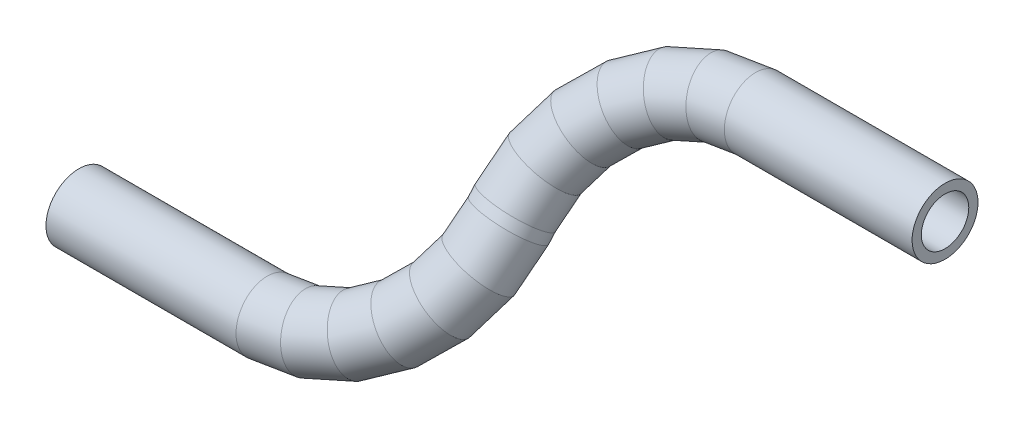
from build123d import *

# Parameters (mm, degrees)
PROFILE_R   = 3.175
PROFILE_R_2 = 2.286


with BuildPart() as part:
    # Tube: sweep along a curve in space
    with BuildLine() as tube_path:
        Line((-2080.987960479, -26.697560814, 19.396913326), (-2099.187960479, -26.697560814, 19.396913326))
        Line((-2099.187960479, -26.697560814, 19.396913326), (-2102.909081944, -27.076898087, 19.672517987))
        Line((-2102.909081944, -27.076898087, 19.672517987), (-2106.397565517, -28.191194413, 20.482101656))
        Line((-2106.397565517, -28.191194413, 20.482101656), (-2109.435317411, -29.970785969, 21.775050604))
        Line((-2109.435317411, -29.970785969, 21.775050604), (-2111.832422782, -32.304415858, 23.470531963))
        Line((-2111.832422782, -32.304415858, 23.470531963), (-2113.439018869, -35.046189691, 25.462547255))
        Line((-2113.439018869, -35.046189691, 25.462547255), (-2114.154664142, -38.024696646, 27.626559228))
        Line((-2114.154664142, -38.024696646, 27.626559228), (-2114.221256816, -38.83191782, 28.21303974))
        Line((-2114.221256816, -38.83191782, 28.21303974), (-2114.936902089, -41.810424775, 30.377051713))
        Line((-2114.936902089, -41.810424775, 30.377051713), (-2116.543498176, -44.552198608, 32.369067005))
        Line((-2116.543498176, -44.552198608, 32.369067005), (-2118.940603547, -46.885828496, 34.064548363))
        Line((-2118.940603547, -46.885828496, 34.064548363), (-2121.978355441, -48.665420053, 35.357497311))
        Line((-2121.978355441, -48.665420053, 35.357497311), (-2125.466839013, -49.779716379, 36.167080981))
        Line((-2125.466839013, -49.779716379, 36.167080981), (-2129.187960479, -50.159053651, 36.442685642))
        Line((-2129.187960479, -50.159053651, 36.442685642), (-2147.387960479, -50.159053651, 36.442685642))
    # Profile → Tube (sweep)
    with BuildSketch(Plane(origin=(-2080.987960479, 0, 0), x_dir=(0, 0, -1), z_dir=(1, 0, 0))):
        with Locations((-19.396913326, -26.697560814)):
            Circle(PROFILE_R)
        with Locations((-19.396913326, -26.697560814)):
            Circle(PROFILE_R_2, mode=Mode.SUBTRACT)
    sweep(path=tube_path.line, transition=Transition.RIGHT)


solid = part.part
